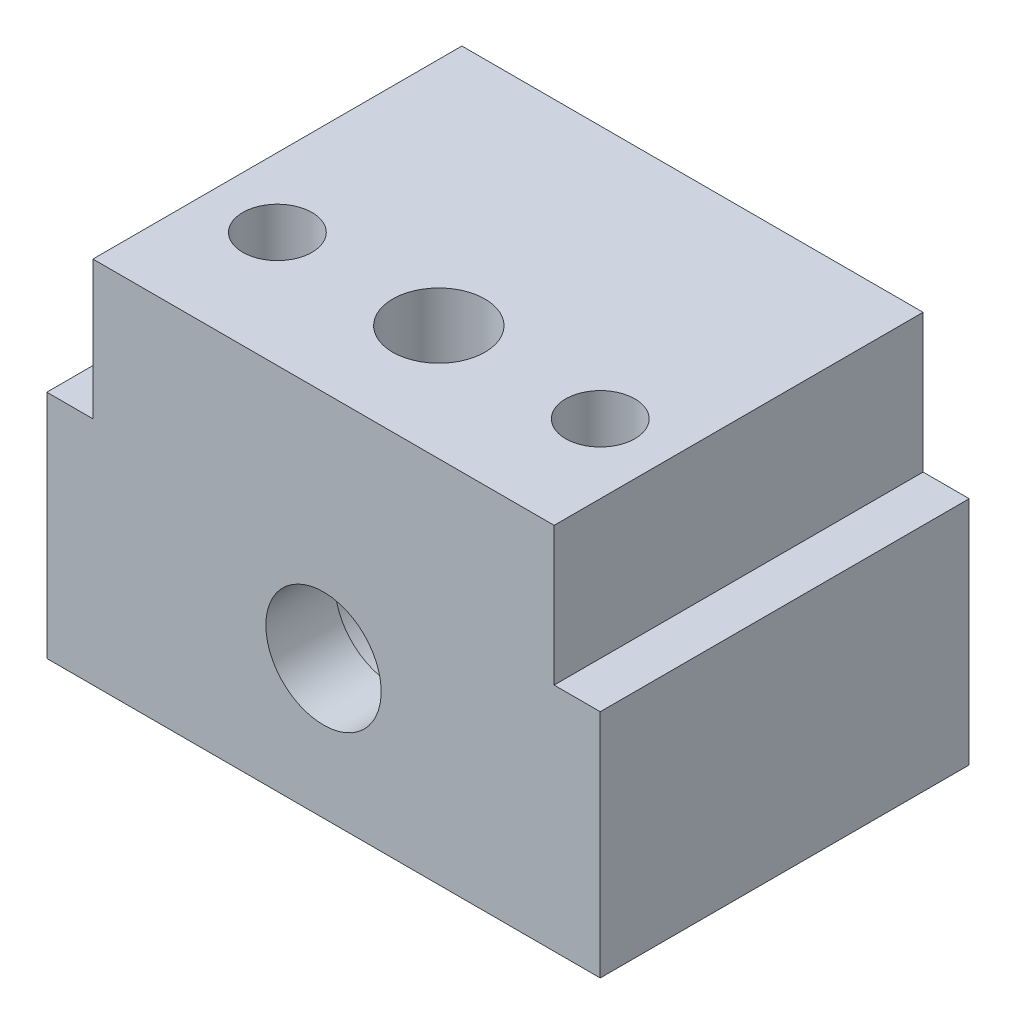
from build123d import *

# Parameters (mm, degrees)
BOSS_EXTRUDE1_DEPTH                                 = 20.32
CBORE_FOR_0_BINDING_HEAD_MACHINE_SCREW1_D           = 6.35
CBORE_FOR_0_BINDING_HEAD_MACHINE_SCREW1_CBORE_D     = 8.89
CBORE_FOR_0_BINDING_HEAD_MACHINE_SCREW1_CBORE_DEPTH = 16.51
CUT_EXTRUDE1_DEPTH                                  = 42.890753156
CUT_EXTRUDE1_DEPTH_BACK                             = 42.890753156
SKETCH5_R                                           = 1.905
SKETCH6_R                                           = 2.54
CUT_EXTRUDE2_DEPTH                                  = 7.62
CUT_EXTRUDE3_DEPTH                                  = 7.62


with BuildPart() as part:
    # Sketch1 → Boss-Extrude1 (new body)
    with BuildSketch(Plane.XY):
        Polygon((0, 0), (0, 12.7), (2.54, 12.7), (2.54, 20.32), (27.94, 20.32), (27.94, 12.7), (30.48, 12.7), (30.48, 0), align=None)
    extrude(amount=-BOSS_EXTRUDE1_DEPTH)

    # CBORE for #0 Binding Head Machine Screw1 (through all)
    with Locations(Plane(origin=(0, 0, -20.32), x_dir=(-1, 0, 0), z_dir=(0, 0, -1))):
        with Locations((-15.24, 7.62)):
            CounterBoreHole(CBORE_FOR_0_BINDING_HEAD_MACHINE_SCREW1_D / 2, CBORE_FOR_0_BINDING_HEAD_MACHINE_SCREW1_CBORE_D / 2, CBORE_FOR_0_BINDING_HEAD_MACHINE_SCREW1_CBORE_DEPTH)

    # Sketch5 → Cut-Extrude1 (cut, two sides: drawn at the far end of the back side and taken through both)
    with BuildSketch(Plane(origin=(0, 20.32, 0), x_dir=(1, 0, 0), z_dir=(0, 1, 0)).offset(-CUT_EXTRUDE1_DEPTH_BACK)):
        with Locations(Location((6.35, 6.35, 0), (0, 0, 270))):
            Circle(SKETCH5_R)
        with Locations(Location((24.13, 6.35, 0), (0, 0, 270))):
            Circle(SKETCH5_R)
    extrude(amount=CUT_EXTRUDE1_DEPTH + CUT_EXTRUDE1_DEPTH_BACK, mode=Mode.SUBTRACT)

    # Sketch6 → Cut-Extrude2 (cut)
    with BuildSketch(Plane(origin=(0, 20.32, 0), x_dir=(1, 0, 0), z_dir=(0, 1, 0))):
        with Locations(Location((15.24, 6.35, 0), (0, 0, 270))):
            Circle(SKETCH6_R)
    extrude(amount=-CUT_EXTRUDE2_DEPTH, mode=Mode.SUBTRACT)

    # Sketch7 → Cut-Extrude3 (cut)
    with BuildSketch(Plane.XZ):
        Polygon((1.950590949, -6.35), (4.150295474, -10.16), (8.549704526, -10.16), (10.749409051, -6.35), (8.549704526, -2.54), (4.150295474, -2.54), align=None)
        Polygon((19.730590949, -6.35), (21.930295474, -10.16), (26.329704526, -10.16), (28.529409051, -6.35), (26.329704526, -2.54), (21.930295474, -2.54), align=None)
    extrude(amount=-CUT_EXTRUDE3_DEPTH, mode=Mode.SUBTRACT)


solid = part.part
